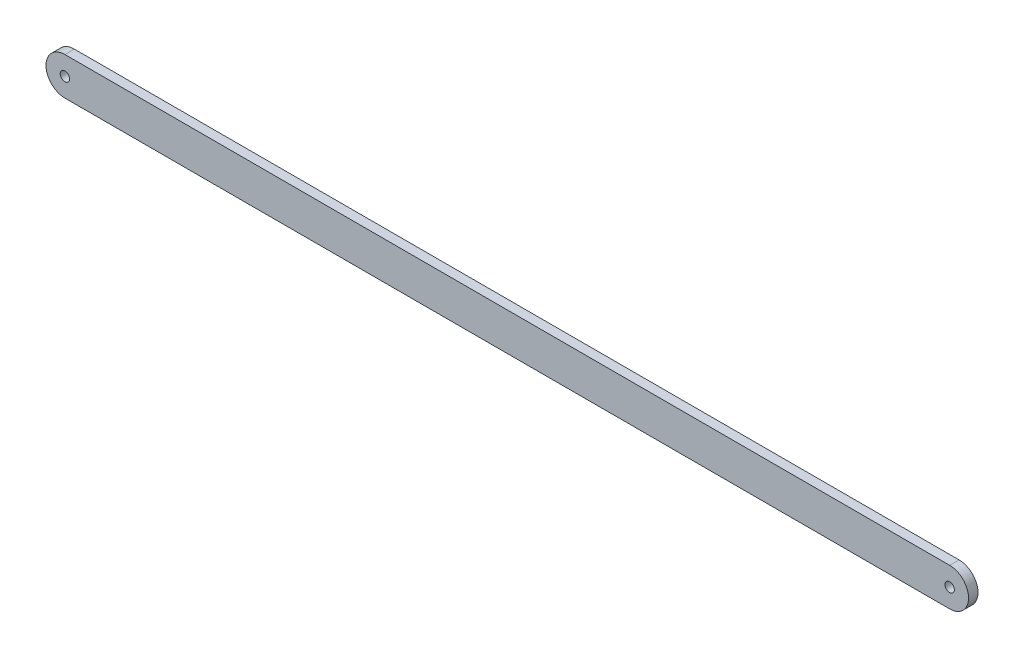
from build123d import *

# Parameters (mm, degrees)
SKETCH1_R           = 1.5875
BOSS_EXTRUDE2_DEPTH = 1.6


with BuildPart() as part:
    # Sketch1 → Boss-Extrude2 (new, symmetric)
    with BuildSketch(Plane.XY):
        with BuildLine():
            Line((-150, 6.4), (150, 6.4))
            ThreePointArc((150, 6.4), (156.40001304, 1.3039e-05), (150.000026079, -6.4))
            Line((150.000026079, -6.4), (-150.000026079, -6.4))
            ThreePointArc((-150.000026079, -6.4), (-156.4, 1.3039e-05), (-150, 6.4))
        make_face()
        with Locations((-150, 0)):
            Circle(SKETCH1_R, mode=Mode.SUBTRACT)
        with Locations((150.00001304, 0)):
            Circle(SKETCH1_R, mode=Mode.SUBTRACT)
    extrude(amount=BOSS_EXTRUDE2_DEPTH, both=True)


solid = part.part
